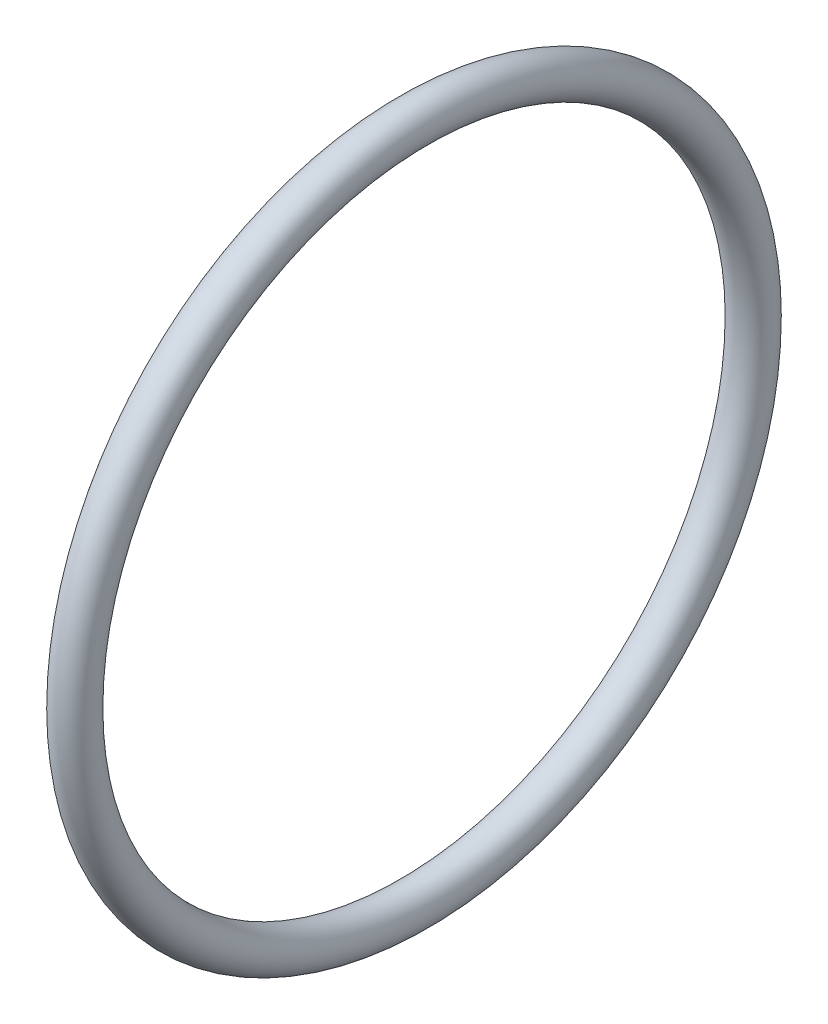
from build123d import *

# Parameters (mm, degrees)
SKETCH_1_R = 1.765


with BuildPart() as part:
    # 草图1 → 旋转1 (revolve)
    with BuildSketch(Plane.XY, mode=Mode.PRIVATE) as revolve_1_sk:
        with Locations((0, 30.135)):
            Circle(SKETCH_1_R)
    revolve(revolve_1_sk.sketch.rotate(Axis((0, 0, 0), (1, 0, 0)), 90), axis=Axis((0, 0, 0), (1, 0, 0)))


solid = part.part
